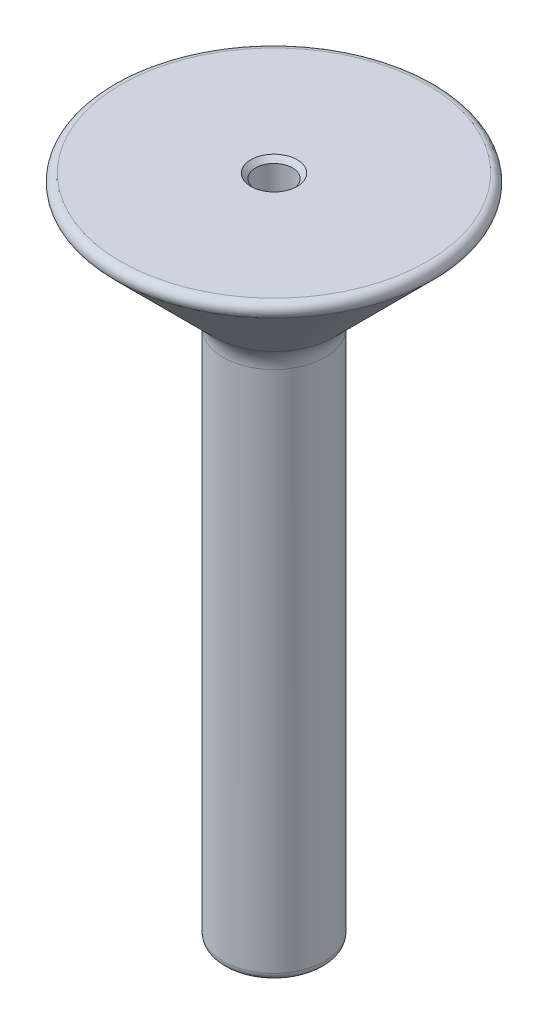
from build123d import *

# Parameters (mm, degrees)
CHAMFER1_SIZE = 0.762
FILLET1_R     = 1.27
FILLET2_R     = 1.27
FILLET3_R     = 5.08


with BuildPart() as part:
    # Sketch1 → Revolve1 (revolve)
    with BuildSketch(Plane.XY, mode=Mode.PRIVATE) as revolve1_sk:
        Polygon((-27.94, 107.95), (-8.255, 88.265), (-8.255, 0), (-5.08, 0), (-5.08, 12.7), (0, 12.7), (0, 98.95), (-3, 98.95), (-3, 107.95), align=None)
    revolve(revolve1_sk.sketch.rotate(Axis((0, 12.7, 0), (0, 1, 0)), 270), axis=Axis((0, 12.7, 0), (0, 1, 0)))

    # Chamfer1
    chamfer1_edges = [part.edges().sort_by_distance(p)[0] for p in [
        (0, 0, 5.08),
        (0, 107.95, 3),
    ]]
    chamfer(chamfer1_edges, length=CHAMFER1_SIZE)

    # Fillet1
    fillet1_edges = [part.edges().sort_by_distance(p)[0] for p in [
        (0, 0, 8.255),
    ]]
    fillet(fillet1_edges, radius=FILLET1_R)

    # Fillet2
    fillet2_edges = [part.edges().sort_by_distance(p)[0] for p in [
        (0, 107.95, 27.94),
    ]]
    fillet(fillet2_edges, radius=FILLET2_R)

    # Fillet3
    fillet3_edges = [part.edges().sort_by_distance(p)[0] for p in [
        (0, 88.265, 8.255),
    ]]
    fillet(fillet3_edges, radius=FILLET3_R)


solid = part.part
